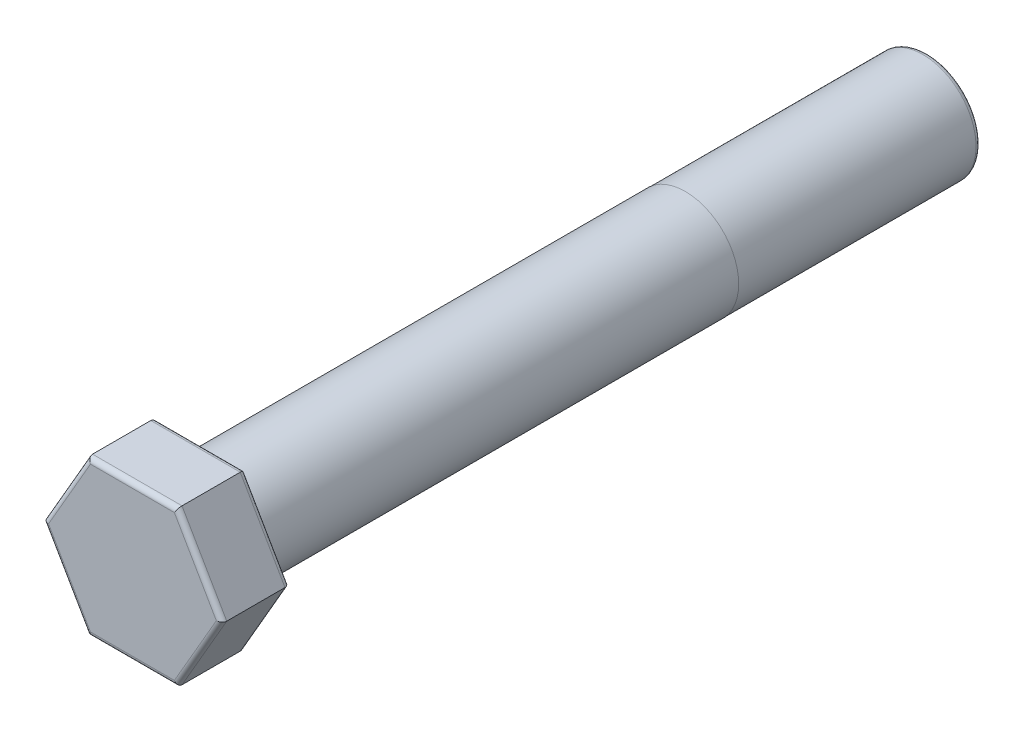
from build123d import *

# Parameters (mm, degrees)
EXTRUDE_1_DEPTH = 14
SKETCH_3_R      = 11
EXTRUDE_2_DEPTH = 100
SKETCH_4_R      = 10.95
EXTRUDE_4_DEPTH = 50
FILLET_2_R      = 1


with BuildPart() as part:
    # 草图2 → 拉伸1 (new body)
    with BuildSketch(Plane.XY):
        Polygon((9.225, -15.9781687), (18.45, 0), (9.225, 15.9781687), (-9.225, 15.9781687), (-18.45, 0), (-9.225, -15.9781687), align=None)
    extrude(amount=EXTRUDE_1_DEPTH)

    # 草图3 → 拉伸2 (add)
    with BuildSketch(Plane(origin=(0, 0, 0), x_dir=(-1, 0, 0), z_dir=(0, 0, -1))):
        with Locations(Location((0, 0, 0), (0, 0, 180))):
            Circle(SKETCH_3_R)
    extrude(amount=EXTRUDE_2_DEPTH)

    # 草图4 → 拉伸4 (add)
    with BuildSketch(Plane(origin=(0, 0, -100), x_dir=(-1, 0, 0), z_dir=(0, 0, -1))):
        Circle(SKETCH_4_R)
    extrude(amount=EXTRUDE_4_DEPTH)

    # 圆角2
    fillet_2_edges = [part.edges().sort_by_distance(p)[0] for p in [
        (13.8375, 7.98908435, 14),
        (0, 15.9781687, 14),
        (-13.8375, 7.98908435, 14),
        (-13.8375, -7.98908435, 14),
        (10.95, 0, -150),
        (0, -15.9781687, 14),
        (-13.8375, -7.98908435, 0),
        (-13.8375, 7.98908435, 0),
        (0, 15.9781687, 0),
        (13.8375, -7.98908435, 14),
        (13.8375, 7.98908435, 0),
        (13.8375, -7.98908435, 0),
        (0, -15.9781687, 0),
    ]]
    fillet(fillet_2_edges, radius=FILLET_2_R)


solid = part.part
